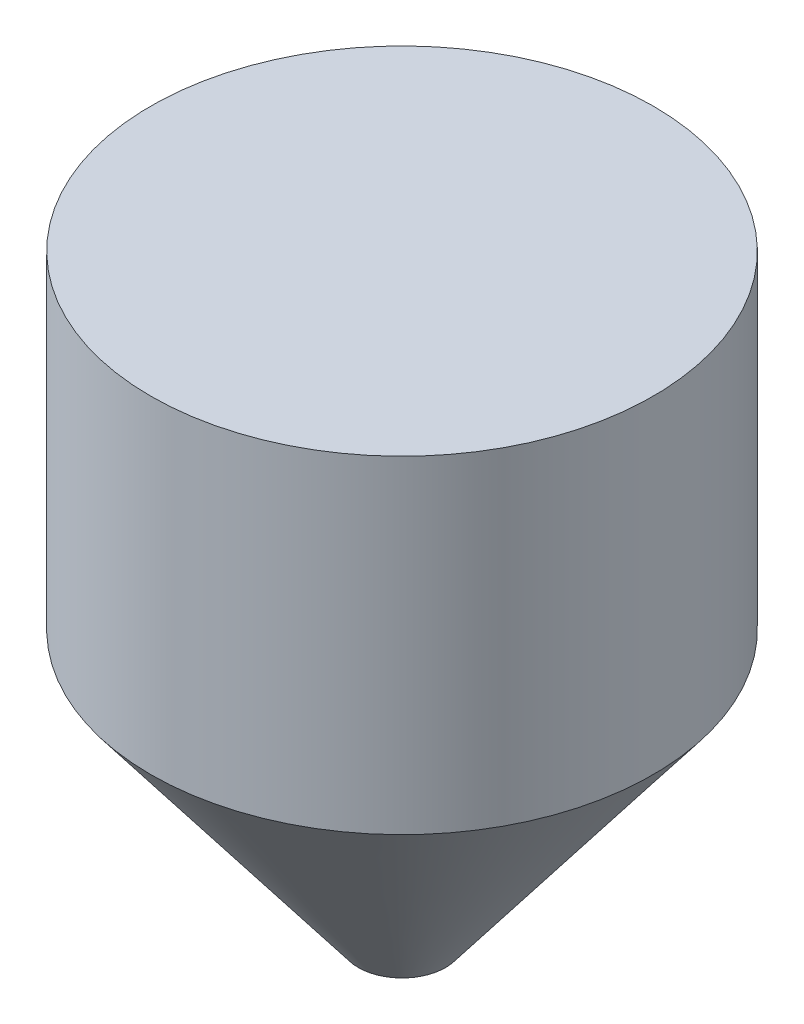
from build123d import *

# Parameters (mm, degrees)
CROQUIS1_R              = 115
SALIENTE_EXTRUIR1_DEPTH = 150
CROQUIS3_R              = 20
CROQUIS2_R              = 115


with BuildPart() as part:
    # Croquis1 → Saliente-Extruir1 (new body)
    with BuildSketch(Plane(origin=(0, 0, 0), x_dir=(1, 0, 0), z_dir=(0, 1, 0))):
        with Locations(Location((0, 0, 0), (0, 0, 270))):
            Circle(CROQUIS1_R)
    extrude(amount=-SALIENTE_EXTRUIR1_DEPTH)

    # Croquis3 → Recubrir1 section 0
    with BuildSketch(Plane(origin=(0, -274, 0), x_dir=(1, 0, 0), z_dir=(0, 1, 0))):
        Circle(CROQUIS3_R)
    # Croquis2 → Recubrir1 section 1
    with BuildSketch(Plane.XZ.offset(150)):
        Circle(CROQUIS2_R)
    loft()


solid = part.part
